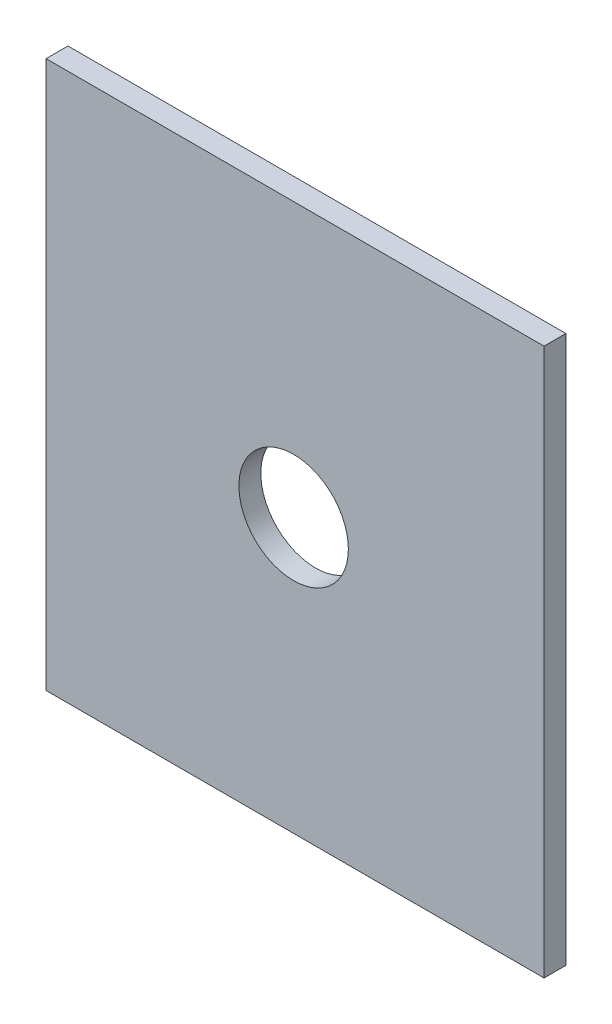
from build123d import *

# Parameters (mm, degrees)
SKETCH1_W           = 91
SKETCH1_H           = 100
SKETCH1_R           = 10
BOSS_EXTRUDE1_DEPTH = 4


with BuildPart() as part:
    # Sketch1 → Boss-Extrude1 (new body)
    with BuildSketch(Plane.XY):
        with Locations((-10.5, 0)):
            Rectangle(SKETCH1_W, SKETCH1_H)
        with Locations((-10.76, 0)):
            Circle(SKETCH1_R, mode=Mode.SUBTRACT)
    extrude(amount=BOSS_EXTRUDE1_DEPTH)


solid = part.part
